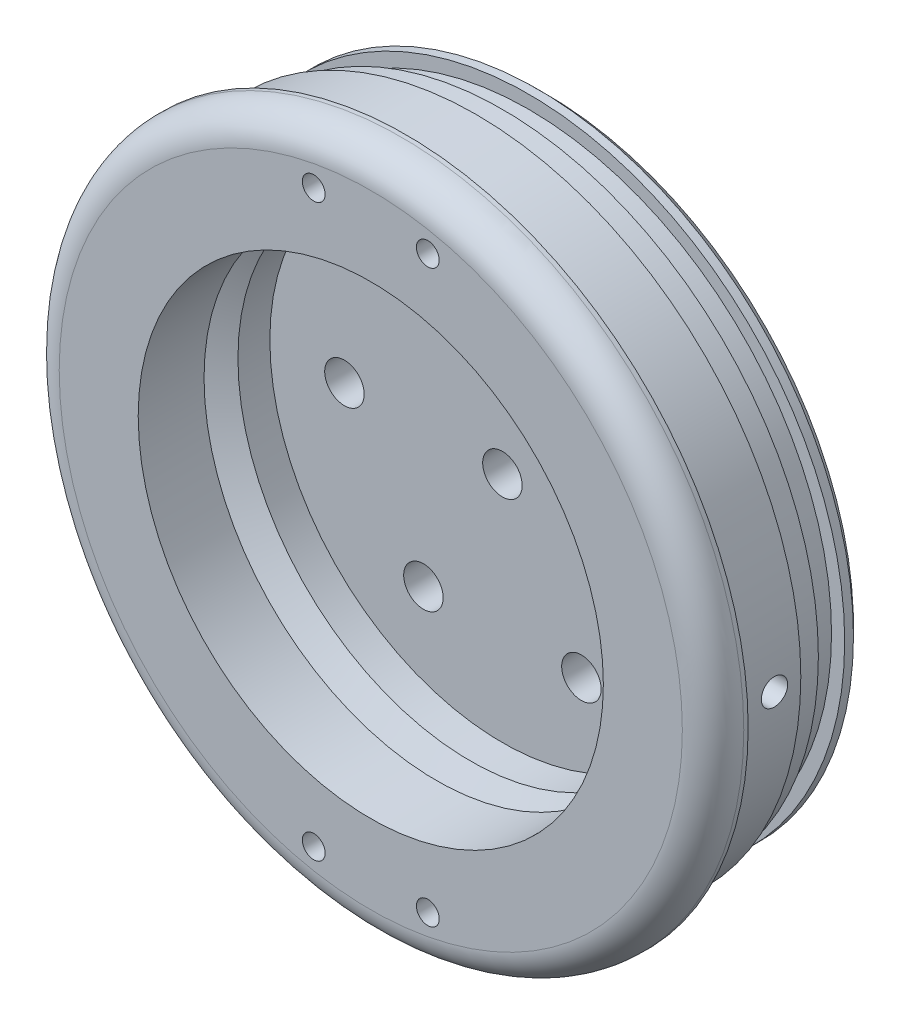
from build123d import *

# Parameters (mm, degrees)
SKETCH_1_R               = 39
EXTRUDE_1_DEPTH          = 4
FILLET_1_R               = 3.5
SKETCH_3_R               = 37
EXTRUDE_2_DEPTH          = 8
SKETCH_4_R               = 36
EXTRUDE_3_DEPTH          = 8
SKETCH_5_W               = 3
SKETCH_5_H               = 1.5
SKETCH_7_R               = 27
CUT_EXTRUDE_1_DEPTH      = 17
CHAMFER_2_SIZE           = 1
SKETCH_18_R              = 1.3
CUT_EXTRUDE_6_DEPTH      = 7
EXTRUDE_START            = 17
SKETCH_19_R              = 27
EXTRUDE_4_DEPTH          = 17
SKETCH_20_R              = 26.5
CUT_EXTRUDE_7_DEPTH      = 15
SKETCH_21_R              = 2.25
CUT_EXTRUDE_8_DEPTH      = 15
SKETCH_23_R              = 1.3
CUT_EXTRUDE_9_DEPTH      = 7
CUT_EXTRUDE_START        = 38
SKETCH_25_R              = 1.5
CUT_EXTRUDE_11_DEPTH     = 4
PATTERN_CIRCULAR_2_COUNT = 2


with BuildPart() as part:
    # Sketch 1 → Бобышка-Вытянуть1 (new body)
    with BuildSketch(Plane.XY):
        Circle(SKETCH_1_R)
    extrude(amount=EXTRUDE_1_DEPTH)

    # Скругление1
    fillet_1_edges = [part.edges().sort_by_distance(p)[0] for p in [
        (-39, 0, 4),
    ]]
    fillet(fillet_1_edges, radius=FILLET_1_R)

    # Эскиз3 → Бобышка-Вытянуть2 (add)
    with BuildSketch(Plane(origin=(0, 0, 0), x_dir=(-1, 0, 0), z_dir=(0, 0, -1))):
        with Locations(Location((0, 0, 0), (0, 0, 180))):
            Circle(SKETCH_3_R)
    extrude(amount=EXTRUDE_2_DEPTH)

    # Эскиз4 → Бобышка-Вытянуть3 (add)
    with BuildSketch(Plane(origin=(0, 0, -8), x_dir=(-1, 0, 0), z_dir=(0, 0, -1))):
        Circle(SKETCH_4_R)
    extrude(amount=EXTRUDE_3_DEPTH)

    # Эскиз5 → Вырез-Повернуть1 (revolve, cut)
    with BuildSketch(Plane(origin=(0, 0, 0), x_dir=(0, 0, -1), z_dir=(1, 0, 0)), mode=Mode.PRIVATE) as cut_revolve_1_sk:
        with Locations((12.5, 35.25)):
            Rectangle(SKETCH_5_W, SKETCH_5_H)
    revolve(cut_revolve_1_sk.sketch.rotate(Axis((0, 0, 46.650977883), (0, 0, -1)), 90), axis=Axis((0, 0, 46.650977883), (0, 0, -1)), mode=Mode.SUBTRACT)

    # Эскиз7 → Вырез-Вытянуть1 (cut)
    with BuildSketch(Plane(origin=(0, 0, -16), x_dir=(-1, 0, 0), z_dir=(0, 0, -1))):
        Circle(SKETCH_7_R)
    extrude(amount=-CUT_EXTRUDE_1_DEPTH, mode=Mode.SUBTRACT)

    # Фаска2
    chamfer_2_edges = [part.edges().sort_by_distance(p)[0] for p in [
        (36, 0, -16),
    ]]
    chamfer(chamfer_2_edges, length=CHAMFER_2_SIZE)

    # Эскиз18 → Вырез-Вытянуть6 (cut)
    with BuildSketch(Plane.XY.offset(4)):
        with Locations((6.5, 32.5)):
            Circle(SKETCH_18_R)
        with Locations(Location((-6.5, 32.5, 0), (0, 0, 180))):
            Circle(SKETCH_18_R)
        with Locations(Location((6.5, -32.5, 0), (0, 0, 180))):
            Circle(SKETCH_18_R)
        with Locations((-6.5, -32.5)):
            Circle(SKETCH_18_R)
    extrude(amount=-CUT_EXTRUDE_6_DEPTH, mode=Mode.SUBTRACT)

    # Эскиз19 → Бобышка-Вытянуть4 (add)
    with BuildSketch(Plane(origin=(0, 0, 1), x_dir=(-1, 0, 0), z_dir=(0, 0, -1)).offset(EXTRUDE_START)):
        Circle(SKETCH_19_R)
    extrude(amount=-EXTRUDE_4_DEPTH)

    # Эскиз20 → Вырез-Вытянуть7 (cut)
    with BuildSketch(Plane.XY.offset(4)):
        Circle(SKETCH_20_R)
    extrude(amount=-CUT_EXTRUDE_7_DEPTH, mode=Mode.SUBTRACT)

    # Эскиз21 → Вырез-Вытянуть8 (cut)
    with BuildSketch(Plane.XY.offset(-11)):
        with Locations((-18, 0)):
            Circle(SKETCH_21_R)
        with Locations((-9, 15.588457268)):
            Circle(SKETCH_21_R)
        with Locations((9, 15.588457268)):
            Circle(SKETCH_21_R)
        with Locations((18, 0)):
            Circle(SKETCH_21_R)
        with Locations((9, -15.588457268)):
            Circle(SKETCH_21_R)
        with Locations((-9, -15.588457268)):
            Circle(SKETCH_21_R)
        Circle(SKETCH_21_R)
    extrude(amount=-CUT_EXTRUDE_8_DEPTH, mode=Mode.SUBTRACT)

    # Эскиз22 → Вырез-Повернуть2 (revolve, cut)
    with BuildSketch(Plane(origin=(0, 0, 0), x_dir=(0, 0, -1), z_dir=(1, 0, 0)), mode=Mode.PRIVATE) as cut_revolve_2_sk:
        Polygon((3.5, 26.5), (5.383390473, 29.817478189), (7.363463637, 26.5), align=None)
    revolve(cut_revolve_2_sk.sketch.rotate(Axis((0, 0, 32.005569053), (0, 0, -1)), 90), axis=Axis((0, 0, 32.005569053), (0, 0, -1)), mode=Mode.SUBTRACT)

    # Эскиз23 → Вырез-Вытянуть9 (cut)
    with BuildSketch(Plane(origin=(0, 0, -16), x_dir=(-1, 0, 0), z_dir=(0, 0, -1))):
        with Locations((23.180408503, 22.060568026)):
            Circle(SKETCH_23_R)
        with Locations(Location((-23.180408503, 22.060568026, 0), (0, 0, 180))):
            Circle(SKETCH_23_R)
        with Locations(Location((23.180408503, -22.060568026, 0), (0, 0, 180))):
            Circle(SKETCH_23_R)
        with Locations((-23.180408503, -22.060568026)):
            Circle(SKETCH_23_R)
    extrude(amount=-CUT_EXTRUDE_9_DEPTH, mode=Mode.SUBTRACT)

    # Эскиз25 → Вырез-Вытянуть11 (cut)
    with BuildSketch(Plane(origin=(0, 0, 0), x_dir=(0, 0, -1), z_dir=(1, 0, 0)).offset(CUT_EXTRUDE_START)):
        with Locations((5, 0)):
            Circle(SKETCH_25_R)
    cut_extrude_11 = extrude(amount=-CUT_EXTRUDE_11_DEPTH, mode=Mode.SUBTRACT)

    # Круговой массив2: Вырез-Вытянуть11 ×2 about axis
    pattern_circular_2_axis = Axis((0, 0, -8), (0, 0, 1))
    for i in range(1, PATTERN_CIRCULAR_2_COUNT):
        add(cut_extrude_11.rotate(pattern_circular_2_axis, i * 360 / PATTERN_CIRCULAR_2_COUNT), mode=Mode.SUBTRACT)


solid = part.part
